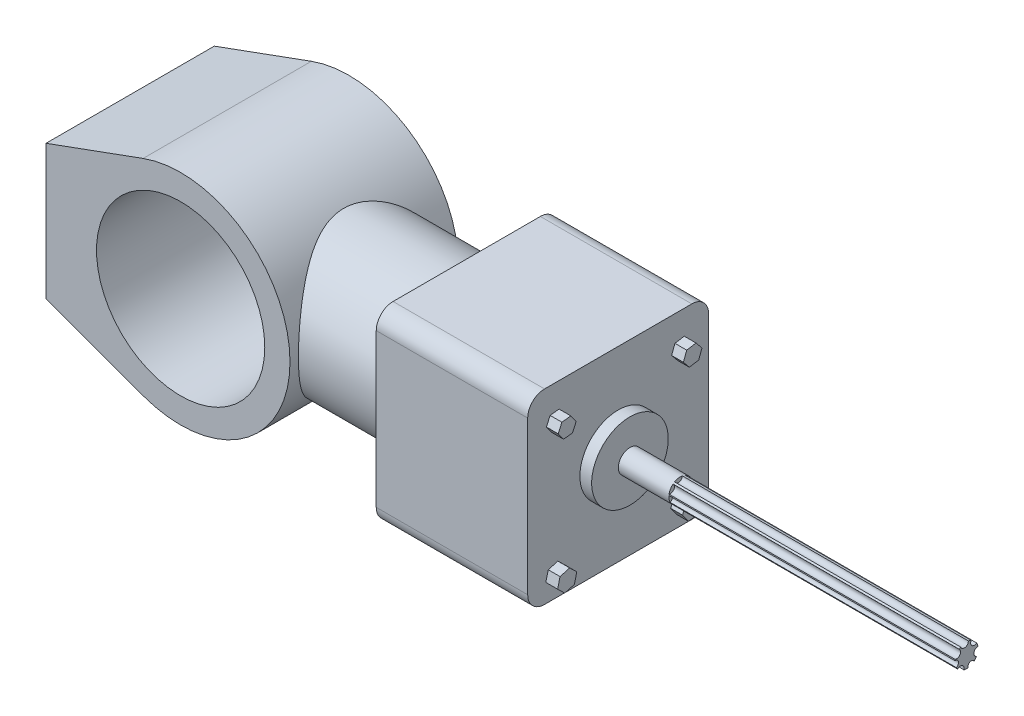
from build123d import *

# Parameters (mm, degrees)
IZIM1_R                          = 50
Y_KSEKLIK_EKSTR_ZYON1_DEPTH      = 50
Y_KSEKLIK_EKSTR_ZYON2_REACH      = 218.16
Y_KSEKLIK_EKSTR_ZYON2_END_RADIUS = 65
IZIM2_R                          = 45
SALIENTE_EXTRUIR1_DEPTH          = 90
CROQUIS2_R                       = 22.752579474
SALIENTE_EXTRUIR2_DEPTH          = 7
SALIENTE_EXTRUIR4_DEPTH          = 7
CROQUIS4_R                       = 6.913256955
SALIENTE_EXTRUIR5_DEPTH          = 200
CROQUIS5_R                       = 2.363211774
CROQUIS5_R_2                     = 2.015238115
CROQUIS5_R_3                     = 2.465720792
CROQUIS5_R_4                     = 2.259668923
CROQUIS5_R_5                     = 2.225924281
CROQUIS5_R_6                     = 2.025363273
CROQUIS5_R_7                     = 2.390624595
CORTAR_EXTRUIR1_DEPTH            = 170


with BuildPart() as part:
    # Çizim1 → Yükseklik-Ekstrüzyon1 (new, symmetric)
    with BuildSketch(Plane.XY):
        with BuildLine():
            Line((-80, -40), (-80, 40))
            Line((-80, 40), (-22.281665693, 61.061668614))
            ThreePointArc((-22.281665693, 61.061668614), (65, 0), (-22.281665693, -61.061668614))
            Line((-22.281665693, -61.061668614), (-80, -40))
        make_face()
        Circle(IZIM1_R, mode=Mode.SUBTRACT)
    extrude(amount=Y_KSEKLIK_EKSTR_ZYON1_DEPTH, both=True)

    # Yükseklik-Ekstrüzyon2: up to this cylinder (the profile starts outside it)
    y_kseklik_ekstr_zyon2_end = Plane(origin=(0, 0, 0), z_dir=(0, 0, -1)) * Cylinder(Y_KSEKLIK_EKSTR_ZYON2_END_RADIUS, 567.32, mode=Mode.PRIVATE)
    # Çizim2 → Yükseklik-Ekstrüzyon2 (add, up to the surface)
    with BuildSketch(Plane(origin=(120, 0, 0), x_dir=(0, 0, -1), z_dir=(1, 0, 0)), mode=Mode.PRIVATE) as y_kseklik_ekstr_zyon2_sk1:
        Circle(IZIM2_R)
    y_kseklik_ekstr_zyon2_tool1 = extrude(y_kseklik_ekstr_zyon2_sk1.sketch, amount=-Y_KSEKLIK_EKSTR_ZYON2_REACH, mode=Mode.PRIVATE) - y_kseklik_ekstr_zyon2_end
    add(y_kseklik_ekstr_zyon2_tool1.solids().sort_by_distance((120, 0, 0))[0])

    # Croquis1 → Saliente-Extruir1 (add)
    with BuildSketch(Plane(origin=(120, 0, 0), x_dir=(0, 0, -1), z_dir=(1, 0, 0))):
        with BuildLine():
            Line((-43.760835361, 55.463261814), (43.760835361, 55.463261814))
            ThreePointArc((43.760835361, 55.463261814), (50.831903173, 52.534329626), (53.760835361, 45.463261814))
            Line((53.760835361, 45.463261814), (53.760835361, -45.463261814))
            ThreePointArc((53.760835361, -45.463261814), (50.831903173, -52.534329626), (43.760835361, -55.463261814))
            Line((43.760835361, -55.463261814), (-43.760835361, -55.463261814))
            ThreePointArc((-43.760835361, -55.463261814), (-50.831903173, -52.534329626), (-53.760835361, -45.463261814))
            Line((-53.760835361, -45.463261814), (-53.760835361, 45.463261814))
            ThreePointArc((-53.760835361, 45.463261814), (-50.831903173, 52.534329626), (-43.760835361, 55.463261814))
        make_face()
    extrude(amount=SALIENTE_EXTRUIR1_DEPTH)

    # Croquis2 → Saliente-Extruir2 (add)
    with BuildSketch(Plane(origin=(210, 0, 0), x_dir=(0, 0, -1), z_dir=(1, 0, 0))):
        Circle(CROQUIS2_R)
    extrude(amount=SALIENTE_EXTRUIR2_DEPTH)

    # Croquis3 → Saliente-Extruir4 (add)
    with BuildSketch(Plane(origin=(210, 0, 0), x_dir=(0, 0, -1), z_dir=(1, 0, 0))):
        Polygon((-34.126669907, 31.505010412), (-31.946398065, 36.408284276), (-35.102621872, 40.748092009), (-40.43911752, 40.18462588), (-42.619389362, 35.281352017), (-39.463165555, 30.941544283), align=None)
        Polygon((40.833645496, 31.505010412), (42.816653349, 36.749955525), (39.265901567, 41.089763259), (33.732141931, 40.18462588), (31.749134077, 34.939680767), (35.299885859, 30.599873033), align=None)
        Polygon((-33.036533986, -47.006056772), (-31.572165729, -41.257329502), (-35.818525457, -37.114785756), (-41.529253441, -38.720969281), (-42.993621697, -44.469696551), (-38.74726197, -48.612240297), align=None)
        Polygon((40.833645496, -47.809148535), (43.341315592, -42.261289535), (39.79056381, -37.315654026), (33.732141931, -37.917877518), (31.224471834, -43.465736518), (34.775223617, -48.411372026), align=None)
    extrude(amount=SALIENTE_EXTRUIR4_DEPTH)

    # Croquis4 → Saliente-Extruir5 (add)
    with BuildSketch(Plane(origin=(217, 0, 0), x_dir=(0, 0, -1), z_dir=(1, 0, 0))):
        Circle(CROQUIS4_R)
    extrude(amount=SALIENTE_EXTRUIR5_DEPTH)

    # Croquis5 → Cortar-Extruir1 (cut)
    with BuildSketch(Plane(origin=(417, 0, 0), x_dir=(0, 0, -1), z_dir=(1, 0, 0))):
        with Locations((-1.260150117, 6.797436533)):
            Circle(CROQUIS5_R)
        with Locations((2.849183045, -6.298831456)):
            Circle(CROQUIS5_R_2)
        with Locations((6.781038585, -1.345599286)):
            Circle(CROQUIS5_R_3)
        with Locations((4.68896459, 5.080032756)):
            Circle(CROQUIS5_R_4)
        with Locations((-3.582760742, -5.912440037)):
            Circle(CROQUIS5_R_5)
        with Locations((-6.781038585, -1.345599286)):
            Circle(CROQUIS5_R_6)
        with Locations((-5.942846302, 3.532095633)):
            Circle(CROQUIS5_R_7)
    extrude(amount=-CORTAR_EXTRUIR1_DEPTH, mode=Mode.SUBTRACT)


solid = part.part
